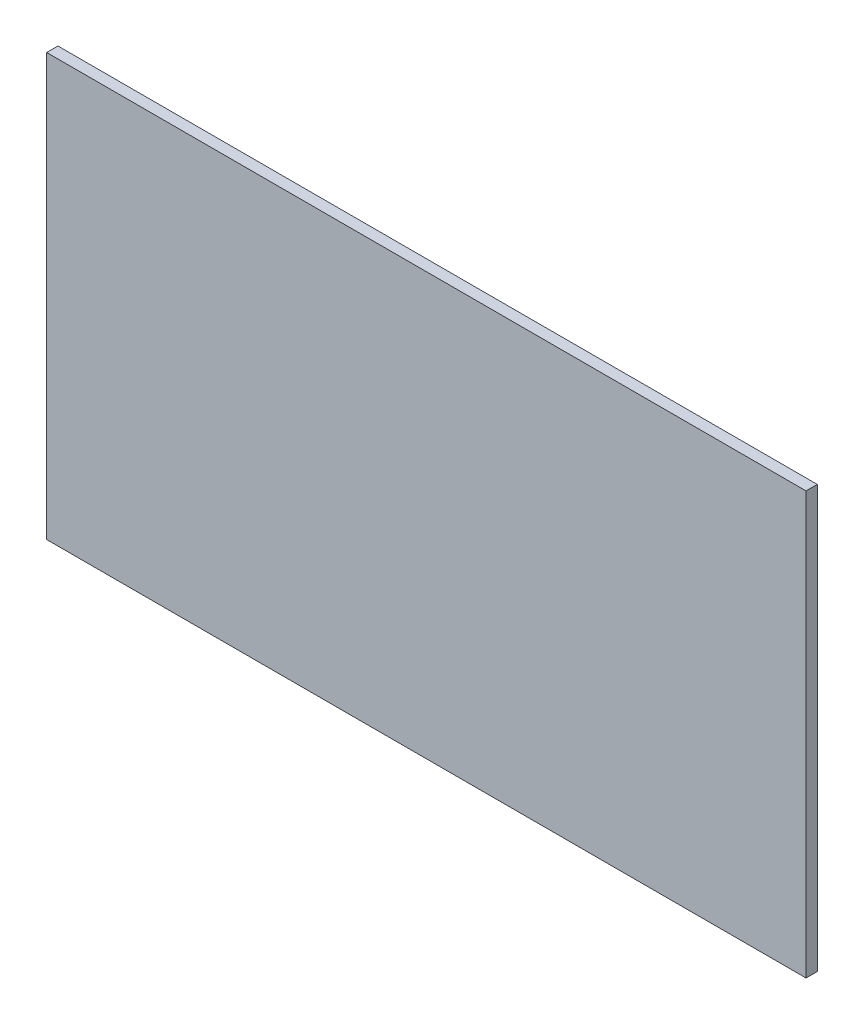
from build123d import *

# Parameters (mm, degrees)
SKETCH1_W           = 135
SKETCH1_H           = 75
BOSS_EXTRUDE1_DEPTH = 2


with BuildPart() as part:
    # Sketch1 → Boss-Extrude1 (new body)
    with BuildSketch(Plane.XY):
        Rectangle(SKETCH1_W, SKETCH1_H)
    extrude(amount=BOSS_EXTRUDE1_DEPTH)


solid = part.part
